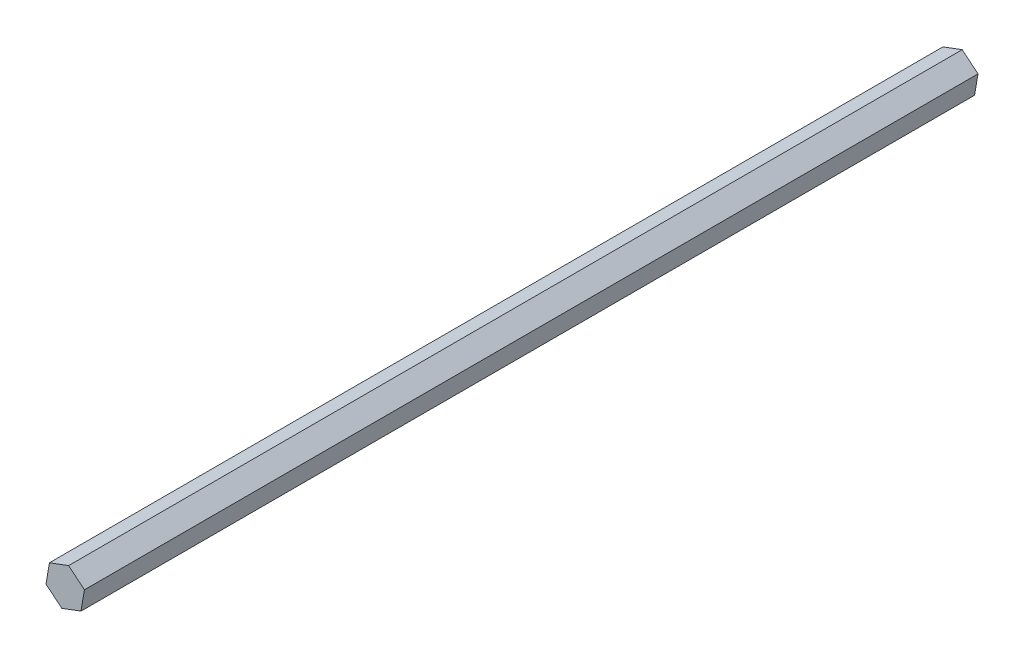
from build123d import *

# Parameters (mm, degrees)
BOSS_EXTRUDE1_DEPTH = 180


with BuildPart() as part:
    # Sketch1 → Boss-Extrude1 (new body)
    with BuildSketch(Plane.XY):
        Polygon((3.180468028, -2.6316262), (3.869289156, 1.438553008), (0.688821129, 4.070179208), (-3.180468028, 2.6316262), (-3.869289156, -1.438553008), (-0.688821129, -4.070179208), align=None)
    extrude(amount=BOSS_EXTRUDE1_DEPTH)


solid = part.part
